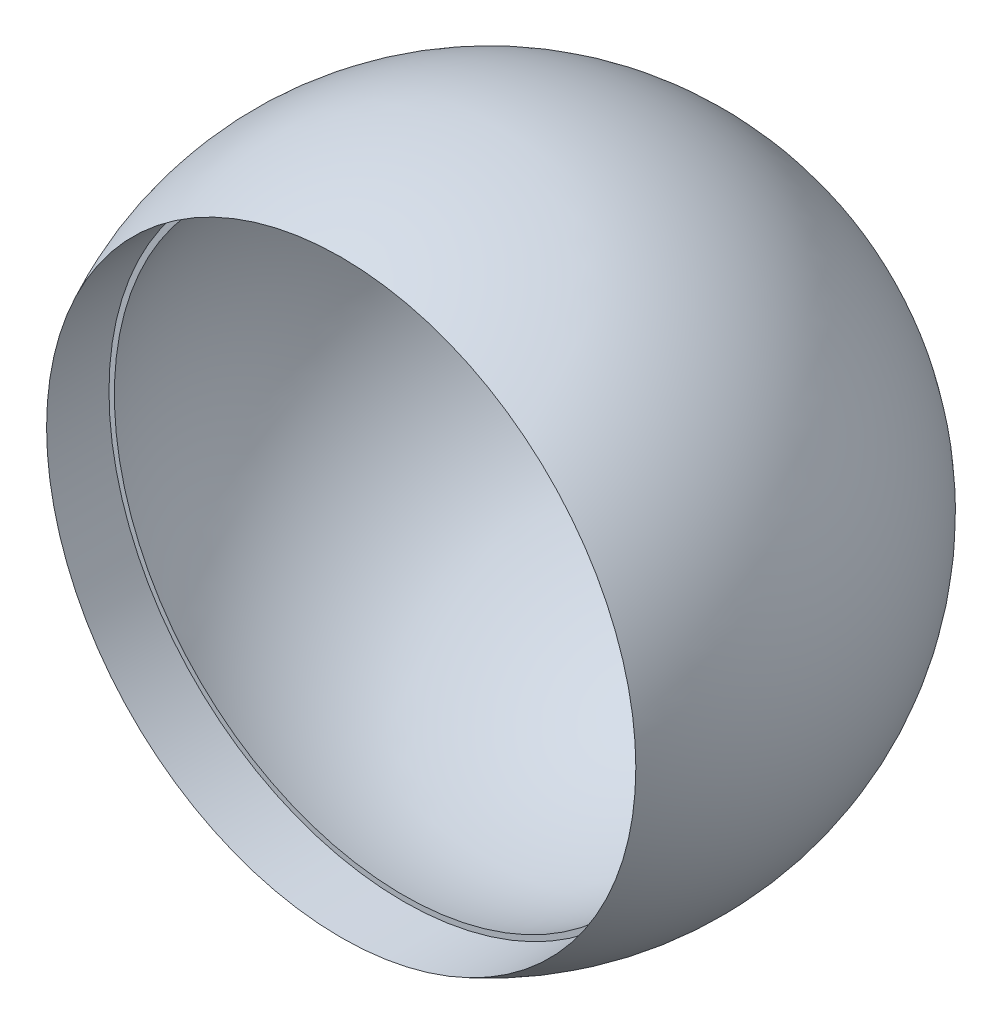
from build123d import *

# Parameters (mm, degrees)
SKETCH_3_R          = 210
CUT_EXTRUDE_1_DEPTH = 174


with BuildPart() as part:
    # 草图1 → 旋转1 (revolve)
    with BuildSketch(Plane.XY):
        with BuildLine():
            ThreePointArc((0, -235), (235, 0), (0, 235))
            Line((0, 235), (0, 215))
            ThreePointArc((0, 215), (215, 0), (0, -215))
            Line((0, -215), (0, -235))
        make_face()
    revolve(axis=Axis((0, 235, 0), (0, -1, 0)))

    # 草图3 → 切除-拉伸1 (cut)
    with BuildSketch(Plane.XY.offset(235)):
        Circle(SKETCH_3_R)
    extrude(amount=-CUT_EXTRUDE_1_DEPTH, mode=Mode.SUBTRACT)


solid = part.part
